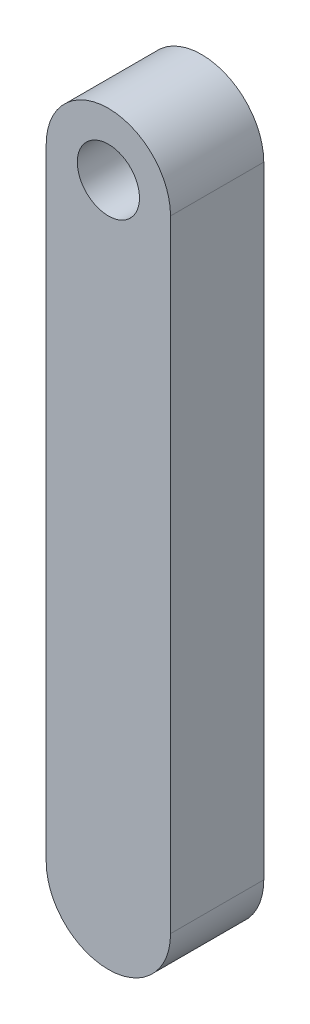
from build123d import *

# Parameters (mm, degrees)
IZIM1_R                     = 1.5
Y_KSEKLIK_EKSTR_ZYON1_DEPTH = 4.5


with BuildPart() as part:
    # Çizim1 → Yükseklik-Ekstrüzyon1 (new body)
    with BuildSketch(Plane.XY):
        with BuildLine():
            Line((-3, 18.97388121), (-3, -11.02611879))
            ThreePointArc((-3, -11.02611879), (0, -14.02611879), (3, -11.02611879))
            Line((3, -11.02611879), (3, 18.97388121))
            ThreePointArc((3, 18.97388121), (0, 21.97388121), (-3, 18.97388121))
        make_face()
        with Locations((0, 18.97388121)):
            Circle(IZIM1_R, mode=Mode.SUBTRACT)
    extrude(amount=Y_KSEKLIK_EKSTR_ZYON1_DEPTH)


solid = part.part
